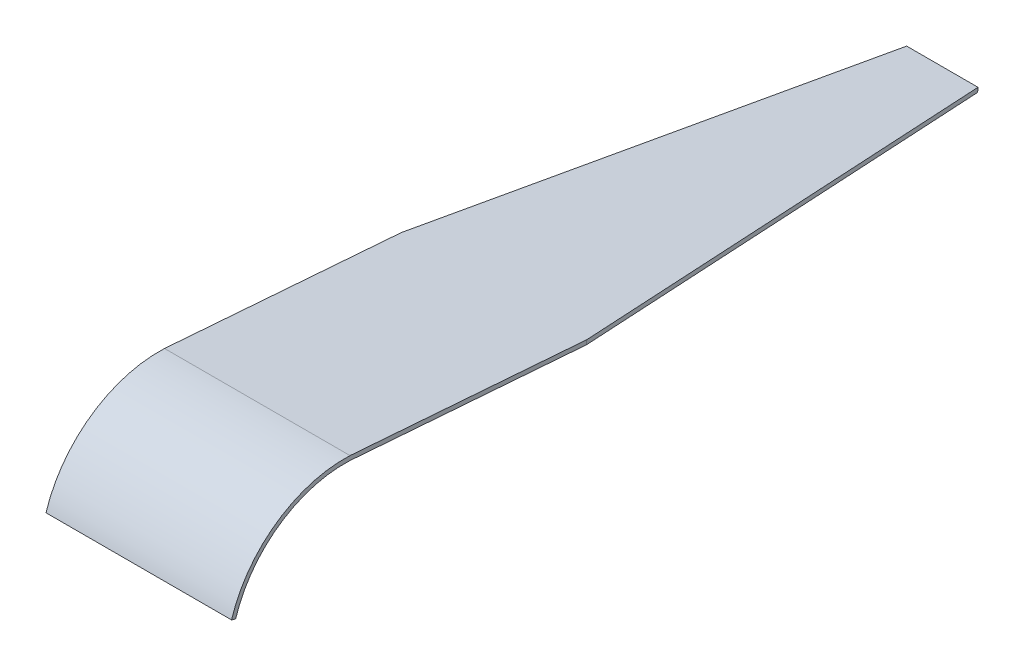
from build123d import *

# Parameters (mm, degrees)
EXTRUDE_THIN2_DEPTH     = 65
CUT_EXTRUDE3_DEPTH      = 186.389784583
CUT_EXTRUDE3_DEPTH_BACK = 186.389784583
CUT_EXTRUDE4_DEPTH      = 186.389784583
CUT_EXTRUDE4_DEPTH_BACK = 186.389784583


with BuildPart() as part:
    # Sketch1 → Extrude-Thin2 (new body)
    with BuildSketch(Plane(origin=(0, 0, 0), x_dir=(0, 0, -1), z_dir=(1, 0, 0))):
        with BuildLine():
            Line((173.642321834, 9.797958971), (-66.357678166, 28.050095))
            ThreePointArc((-66.357678166, 28.050095), (-91.137548283, 20.841238484), (-106.357678166, 0))
            Line((-106.357678166, 0), (-107.789658514, 0.446578419))
            ThreePointArc((-107.789658514, 0.446578419), (-91.989308326, 22.075999038), (-66.266563175, 29.547497166))
            Line((-66.266563175, 29.547497166), (173.756069218, 11.293639931))
            Line((173.756069218, 11.293639931), (173.642321834, 9.797958971))
        make_face()
    extrude(amount=EXTRUDE_THIN2_DEPTH)

    # Sketch2 → Cut-Extrude3 (cut, two sides: drawn at the far end of the back side and taken through both)
    with BuildSketch(Plane(origin=(0, 24.366956586, -1.853120859), x_dir=(1, 0, 0), z_dir=(0, 0.9971206396362033, -0.07583158979929651)).offset(-CUT_EXTRUDE3_DEPTH_BACK)):
        Polygon((93.231917992, 749.14649506), (20, 172.399348209), (0, 14.886842005), (-73.231917992, -561.860304846), (-1226.726211693, -415.396468862), (-1060.262375709, 895.610331043), align=None)
    extrude(amount=CUT_EXTRUDE3_DEPTH + CUT_EXTRUDE3_DEPTH_BACK, mode=Mode.SUBTRACT)

    # Sketch4 → Cut-Extrude4 (cut, two sides: drawn at the far end of the back side and taken through both)
    with BuildSketch(Plane(origin=(0, 24.366956586, -1.853120859), x_dir=(1, 0, 0), z_dir=(0, 0.9971206396362033, -0.07583158979929651)).offset(-CUT_EXTRUDE4_DEPTH_BACK)):
        Polygon((-28.231917992, 749.14649506), (45, 172.399348209), (65, 14.886842005), (138.231917992, -561.860304846), (1291.726211693, -415.396468862), (1125.262375709, 895.610331043), align=None)
    extrude(amount=CUT_EXTRUDE4_DEPTH + CUT_EXTRUDE4_DEPTH_BACK, mode=Mode.SUBTRACT)


solid = part.part
